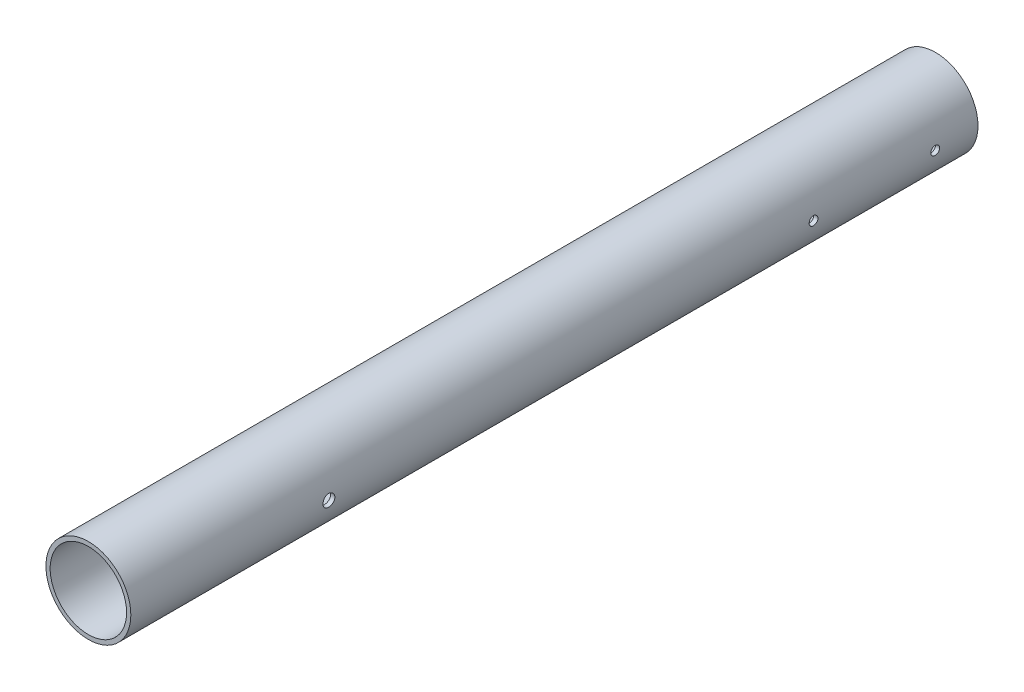
from build123d import *

# Parameters (mm, degrees)
SKETCH_1_R               = 15
SKETCH_1_R_2             = 13.5
EXTRUDE_1_DEPTH          = 299.33
CUT_EXTRUDE_1_DEPTH      = 301.080737302
CUT_EXTRUDE_1_DEPTH_BACK = 301.080737302
SKETCH_2_R               = 1.55
CUT_EXTRUDE_2_DEPTH      = 301.080737413
CUT_EXTRUDE_2_DEPTH_BACK = 301.080737413
SKETCH_3_R               = 2.1


with BuildPart() as part:
    # 草图1 → 凸台-拉伸1 (new body)
    with BuildSketch(Plane.XY):
        Circle(SKETCH_1_R)
        Circle(SKETCH_1_R_2, mode=Mode.SUBTRACT)
    extrude(amount=EXTRUDE_1_DEPTH)

    # 草图2 → 切除-拉伸1 (cut, two sides: drawn at the far end of the back side and taken through both)
    with BuildSketch(Plane(origin=(0, 0, 0), x_dir=(0, 0, -1), z_dir=(1, 0, 0)).offset(-CUT_EXTRUDE_1_DEPTH_BACK)):
        with Locations((-15.1, 0)):
            Circle(SKETCH_2_R)
        with Locations((-58.1, 0)):
            Circle(SKETCH_2_R)
    extrude(amount=CUT_EXTRUDE_1_DEPTH + CUT_EXTRUDE_1_DEPTH_BACK, mode=Mode.SUBTRACT)

    # 草图3 → 切除-拉伸2 (cut, two sides: drawn at the far end of the back side and taken through both)
    with BuildSketch(Plane(origin=(0, 0, 0), x_dir=(0, 0, -1), z_dir=(1, 0, 0)).offset(-CUT_EXTRUDE_2_DEPTH_BACK)):
        with Locations((-229.33, 0)):
            Circle(SKETCH_3_R)
    extrude(amount=CUT_EXTRUDE_2_DEPTH + CUT_EXTRUDE_2_DEPTH_BACK, mode=Mode.SUBTRACT)


solid = part.part
